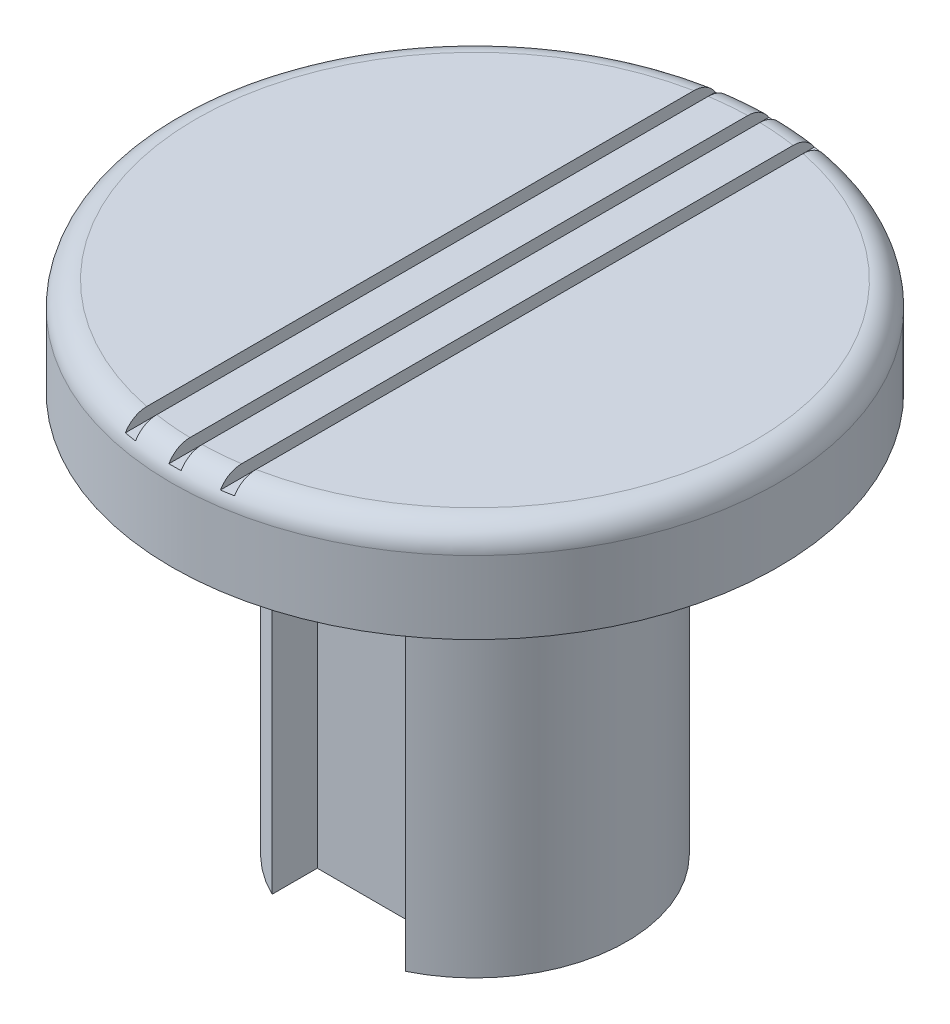
from build123d import *

# Parameters (mm, degrees)
SKETCH1_R           = 6.25
BOSS_EXTRUDE1_DEPTH = 16.5
CUT_EXTRUDE1_REACH  = 20.718
SKETCH2_W           = 5.5
SKETCH2_H           = 5.5
SKETCH3_R           = 12.5
BOSS_EXTRUDE2_DEPTH = 4
FILLET1_R           = 1
SKETCH4_W           = 0.5
SKETCH4_H           = 30
CUT_EXTRUDE2_DEPTH  = 0.5


with BuildPart() as part:
    # Sketch1 → Boss-Extrude1 (new body)
    with BuildSketch(Plane(origin=(0, 0, 0), x_dir=(1, 0, 0), z_dir=(0, 1, 0))):
        with Locations(Location((0, 0, 0), (0, 0, 270))):
            Circle(SKETCH1_R)
    extrude(amount=BOSS_EXTRUDE1_DEPTH)

    # Sketch2 → Cut-Extrude1 (cut, up to next)
    with BuildSketch(Plane(origin=(0, 16.5, 0), x_dir=(1, 0, 0), z_dir=(0, 1, 0)), mode=Mode.PRIVATE) as cut_extrude1_sk1:
        with Locations((0, -6.5)):
            Rectangle(SKETCH2_W, SKETCH2_H)
    cut_extrude1_tool1 = extrude(cut_extrude1_sk1.sketch, amount=-CUT_EXTRUDE1_REACH, mode=Mode.PRIVATE) & part.part
    add(cut_extrude1_tool1.solids().sort_by_distance((0, 16.5, 6.5))[0], mode=Mode.SUBTRACT)

    # Sketch3 → Boss-Extrude2 (add)
    with BuildSketch(Plane(origin=(0, 16.5, 0), x_dir=(1, 0, 0), z_dir=(0, 1, 0))):
        with Locations(Location((0, 0, 0), (0, 0, 270))):
            Circle(SKETCH3_R)
    extrude(amount=BOSS_EXTRUDE2_DEPTH)

    # Fillet1
    fillet1_edges = [part.edges().sort_by_distance(p)[0] for p in [
        (0, 20.5, -12.5),
    ]]
    fillet(fillet1_edges, radius=FILLET1_R)

    # Sketch4 → Cut-Extrude2 (cut)
    with BuildSketch(Plane(origin=(0, 20.5, 0), x_dir=(1, 0, 0), z_dir=(0, 1, 0))):
        Rectangle(SKETCH4_W, SKETCH4_H)
        with Locations((2, 0)):
            Rectangle(SKETCH4_W, SKETCH4_H)
        with Locations((-2, 0)):
            Rectangle(SKETCH4_W, SKETCH4_H)
    extrude(amount=-CUT_EXTRUDE2_DEPTH, mode=Mode.SUBTRACT)


solid = part.part
